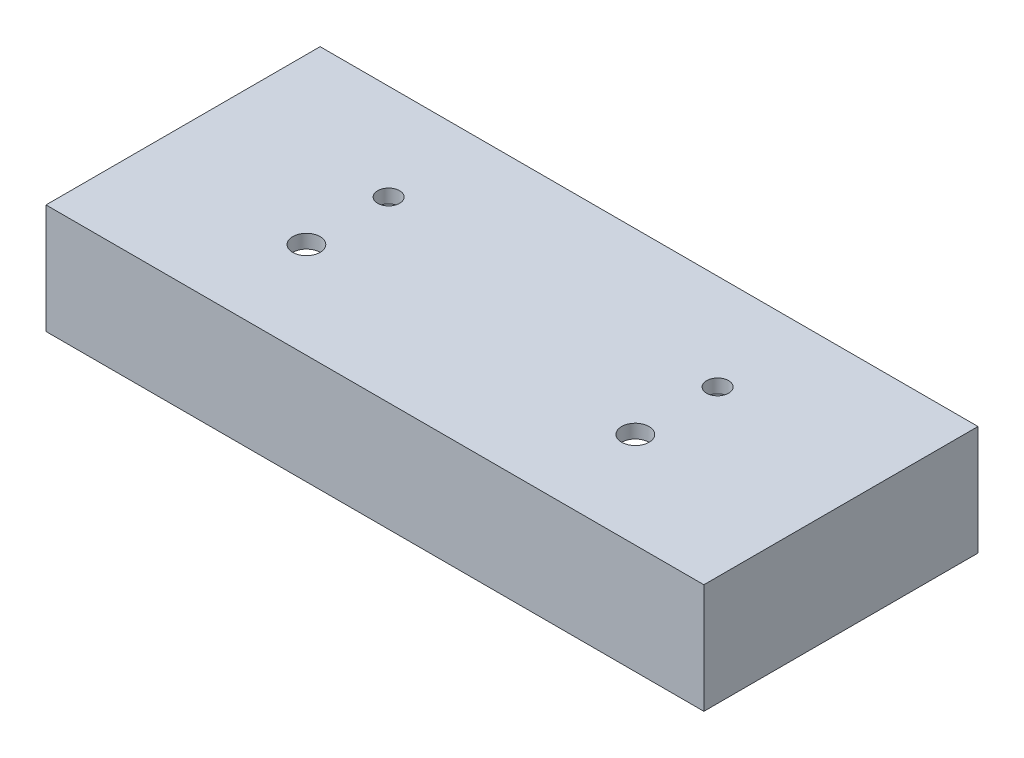
from build123d import *

# Parameters (mm, degrees)
SKETCH1_W           = 304.8
SKETCH1_H           = 127
BOSS_EXTRUDE1_DEPTH = 50.8
SKETCH2_W           = 279.4
SKETCH2_H           = 101.6
CUT_EXTRUDE1_DEPTH  = 44.45
SKETCH3_R           = 5.08
SKETCH3_R_2         = 6.35
CUT_EXTRUDE2_DEPTH  = 12.7


with BuildPart() as part:
    # Sketch1 → Boss-Extrude1 (new body)
    with BuildSketch(Plane(origin=(0, 0, 0), x_dir=(1, 0, 0), z_dir=(0, 1, 0))):
        Rectangle(SKETCH1_W, SKETCH1_H)
    extrude(amount=BOSS_EXTRUDE1_DEPTH)

    # Sketch2 → Cut-Extrude1 (cut)
    with BuildSketch(Plane.XZ):
        Rectangle(SKETCH2_W, SKETCH2_H)
    extrude(amount=-CUT_EXTRUDE1_DEPTH, mode=Mode.SUBTRACT)

    # Sketch3 → Cut-Extrude2 (cut)
    with BuildSketch(Plane(origin=(0, 50.8, 0), x_dir=(1, 0, 0), z_dir=(0, 1, 0))):
        with Locations(Location((-76.2, 19.05, 0), (0, 0, 270))):
            Circle(SKETCH3_R)
        with Locations(Location((76.2, 19.05, 0), (0, 0, 90))):
            Circle(SKETCH3_R)
        with Locations(Location((-76.2, -19.05, 0), (0, 0, 270))):
            Circle(SKETCH3_R_2)
        with Locations(Location((76.2, -19.05, 0), (0, 0, 270))):
            Circle(SKETCH3_R_2)
    extrude(amount=-CUT_EXTRUDE2_DEPTH, mode=Mode.SUBTRACT)


solid = part.part
